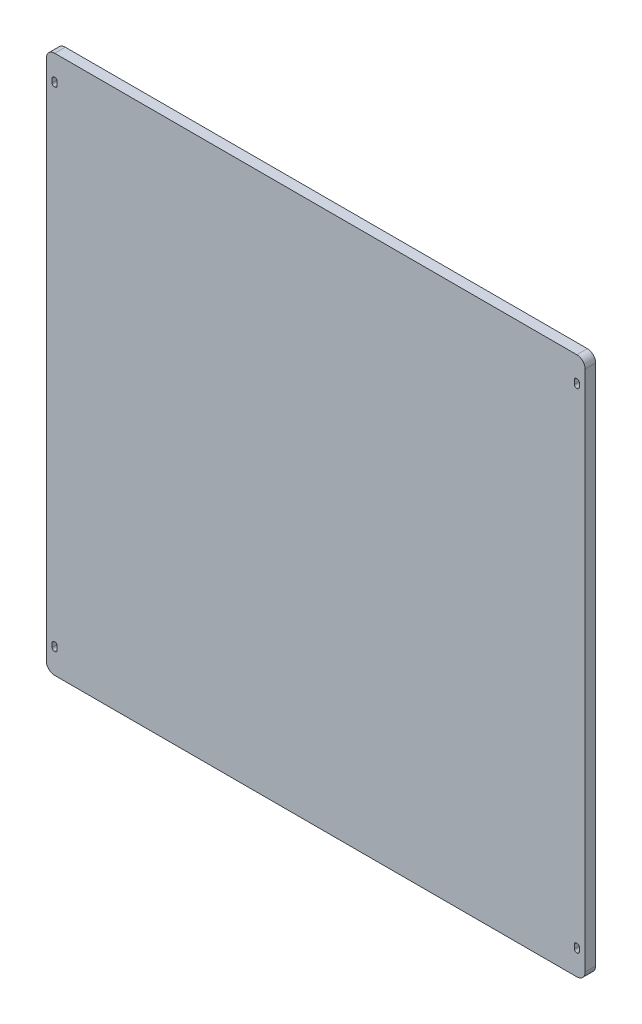
from build123d import *

# Parameters (mm, degrees)
SKETCH1_W           = 647.7
SKETCH1_H           = 647.7
BOSS_EXTRUDE1_DEPTH = 12.7
FILLET1_R           = 10


with BuildPart() as part:
    # Sketch1 → Boss-Extrude1 (new body)
    with BuildSketch(Plane.XY):
        with Locations((6.970281457, -148.520612583)):
            Rectangle(SKETCH1_W, SKETCH1_H)
        with BuildLine():
            Line((321.320281457, -447.370612583), (320.320281457, -447.370612583))
            ThreePointArc((320.320281457, -447.370612583), (318.552514504, -446.638379536), (317.820281457, -444.870612583))
            Line((317.820281457, -444.870612583), (317.820281457, -439.870612583))
            ThreePointArc((317.820281457, -439.870612583), (318.552514504, -438.10284563), (320.320281457, -437.370612583))
            Line((320.320281457, -437.370612583), (321.320281457, -437.370612583))
            ThreePointArc((321.320281457, -437.370612583), (323.08804841, -438.10284563), (323.820281457, -439.870612583))
            Line((323.820281457, -439.870612583), (323.820281457, -444.870612583))
            ThreePointArc((323.820281457, -444.870612583), (323.08804841, -446.638379536), (321.320281457, -447.370612583))
        make_face(mode=Mode.SUBTRACT)
        with BuildLine():
            Line((-306.379718543, -447.370612583), (-307.379718543, -447.370612583))
            ThreePointArc((-307.379718543, -447.370612583), (-309.147485496, -446.638379536), (-309.879718543, -444.870612583))
            Line((-309.879718543, -444.870612583), (-309.879718543, -439.870612583))
            ThreePointArc((-309.879718543, -439.870612583), (-309.147485496, -438.10284563), (-307.379718543, -437.370612583))
            Line((-307.379718543, -437.370612583), (-306.379718543, -437.370612583))
            ThreePointArc((-306.379718543, -437.370612583), (-304.61195159, -438.10284563), (-303.879718543, -439.870612583))
            Line((-303.879718543, -439.870612583), (-303.879718543, -444.870612583))
            ThreePointArc((-303.879718543, -444.870612583), (-304.61195159, -446.638379536), (-306.379718543, -447.370612583))
        make_face(mode=Mode.SUBTRACT)
        with BuildLine():
            Line((-306.379718543, 140.329387417), (-307.379718543, 140.329387417))
            ThreePointArc((-307.379718543, 140.329387417), (-309.147485496, 141.061620464), (-309.879718543, 142.829387417))
            Line((-309.879718543, 142.829387417), (-309.879718543, 147.829387417))
            ThreePointArc((-309.879718543, 147.829387417), (-309.147485496, 149.59715437), (-307.379718543, 150.329387417))
            Line((-307.379718543, 150.329387417), (-306.379718543, 150.329387417))
            ThreePointArc((-306.379718543, 150.329387417), (-304.61195159, 149.59715437), (-303.879718543, 147.829387417))
            Line((-303.879718543, 147.829387417), (-303.879718543, 142.829387417))
            ThreePointArc((-303.879718543, 142.829387417), (-304.61195159, 141.061620464), (-306.379718543, 140.329387417))
        make_face(mode=Mode.SUBTRACT)
        with BuildLine():
            Line((321.320281457, 140.329387417), (320.320281457, 140.329387417))
            ThreePointArc((320.320281457, 140.329387417), (318.552514504, 141.061620464), (317.820281457, 142.829387417))
            Line((317.820281457, 142.829387417), (317.820281457, 147.829387417))
            ThreePointArc((317.820281457, 147.829387417), (318.552514504, 149.59715437), (320.320281457, 150.329387417))
            Line((320.320281457, 150.329387417), (321.320281457, 150.329387417))
            ThreePointArc((321.320281457, 150.329387417), (323.08804841, 149.59715437), (323.820281457, 147.829387417))
            Line((323.820281457, 147.829387417), (323.820281457, 142.829387417))
            ThreePointArc((323.820281457, 142.829387417), (323.08804841, 141.061620464), (321.320281457, 140.329387417))
        make_face(mode=Mode.SUBTRACT)
    extrude(amount=BOSS_EXTRUDE1_DEPTH)

    # Fillet1
    fillet1_edges = [part.edges().sort_by_distance(p)[0] for p in [
        (-316.879718543, 175.329387417, 6.35),
        (-316.879718543, -472.370612583, 6.35),
        (330.820281457, -472.370612583, 6.35),
        (330.820281457, 175.329387417, 6.35),
    ]]
    fillet(fillet1_edges, radius=FILLET1_R)


solid = part.part
